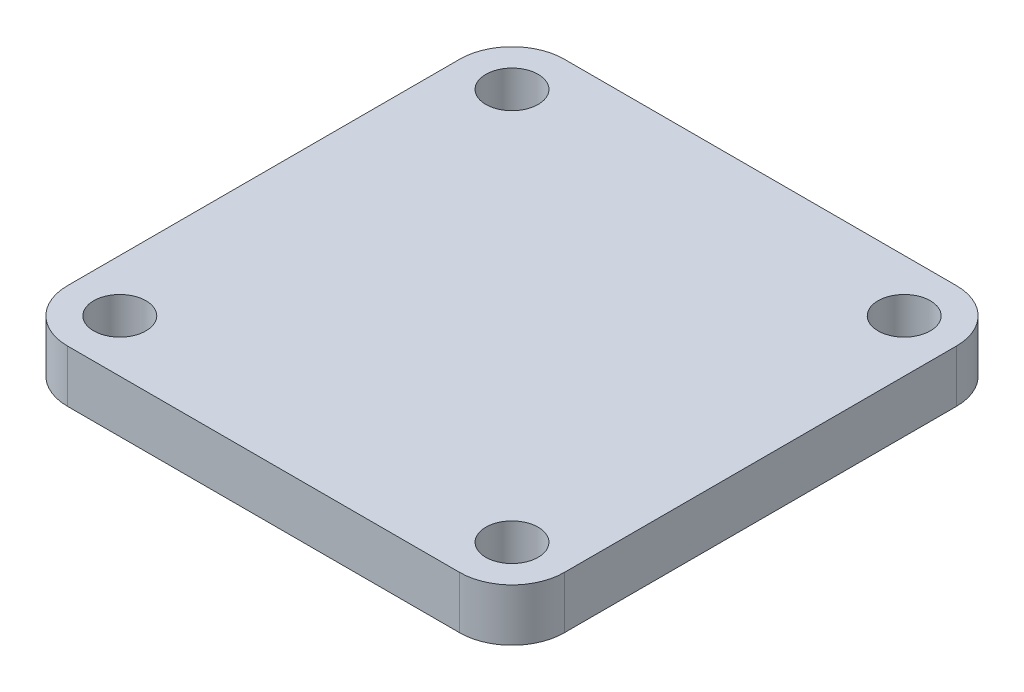
from build123d import *

# Parameters (mm, degrees)
SKETCH_1_R      = 1
EXTRUDE_2_DEPTH = 2


with BuildPart() as part:
    # Эскиз1 → Бобышка-Вытянуть2 (new body)
    with BuildSketch(Plane(origin=(0, 0, 0), x_dir=(1, 0, 0), z_dir=(0, 1, 0))):
        with BuildLine():
            Line((-6.413196558, 8.539893617), (8.586803442, 8.539893617))
            ThreePointArc((8.586803442, 8.539893617), (10.001017004, 7.954107179), (10.586803442, 6.539893617))
            Line((10.586803442, 6.539893617), (10.586803442, -8.460106383))
            ThreePointArc((10.586803442, -8.460106383), (10.001017004, -9.874319945), (8.586803442, -10.460106383))
            Line((8.586803442, -10.460106383), (-6.413196558, -10.460106383))
            ThreePointArc((-6.413196558, -10.460106383), (-7.827410121, -9.874319945), (-8.413196558, -8.460106383))
            Line((-8.413196558, -8.460106383), (-8.413196558, 6.539893617))
            ThreePointArc((-8.413196558, 6.539893617), (-7.827410121, 7.954107179), (-6.413196558, 8.539893617))
        make_face()
        with Locations(Location((-6.413196558, 6.539893617, 0), (0, 0, 270))):
            Circle(SKETCH_1_R, mode=Mode.SUBTRACT)
        with Locations(Location((8.586803442, 6.539893617, 0), (0, 0, 270))):
            Circle(SKETCH_1_R, mode=Mode.SUBTRACT)
        with Locations(Location((8.586803442, -8.460106383, 0), (0, 0, 270))):
            Circle(SKETCH_1_R, mode=Mode.SUBTRACT)
        with Locations(Location((-6.413196558, -8.460106383, 0), (0, 0, 270))):
            Circle(SKETCH_1_R, mode=Mode.SUBTRACT)
    extrude(amount=EXTRUDE_2_DEPTH)


solid = part.part
